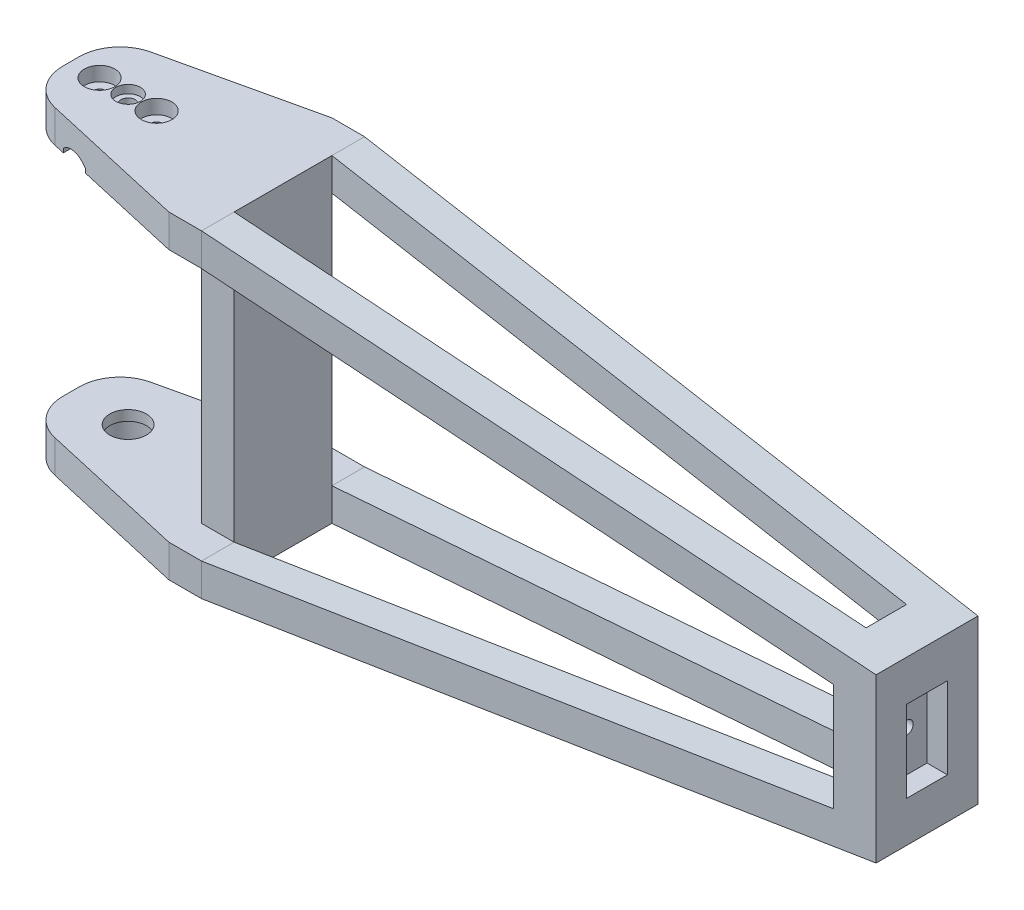
from build123d import *

# Parameters (mm, degrees)
SZKIC1_R                               = 4.5
DODANIE_WYCI_GNI_CIE1_DEPTH            = 8
SZKIC23_R                              = 6.5
WYTNIJ_WYCI_GNI_CIE11_DEPTH            = 5.5
SZKIC4_W                               = 8
SZKIC4_H                               = 40
DODANIE_WYCI_GNI_CIE2_DEPTH            = 62.15
DODANIE_WYCI_GNI_CIE3_DEPTH            = 8
WYTNIJ_WYCI_GNI_CIE3_REACH             = 91.171
SZKIC6_R                               = 1.6
SZKIC7_R                               = 3.75
WYTNIJ_WYCI_GNI_CIE4_DEPTH             = 3.5
WYTNIJ_WYCI_GNI_CIE5_REACH             = 97.976
WYTNIJ_WYCI_GNI_CIE5_DIRECTION_2_REACH = 97.976
SZKIC10_R                              = 3
WYTNIJ_WYCI_GNI_CIE6_DEPTH             = 2
WYTNIJ_WYCI_GNI_CIE7_REACH             = 93.888
SZKIC14_W                              = 8
SZKIC14_H                              = 62.15
DODANIE_WYCI_GNI_CIE5_DEPTH            = 78.15
WYTNIJ_WYCI_GNI_CIE9_DEPTH             = 215.763643338
WYTNIJ_WYCI_GNI_CIE9_DEPTH_BACK        = 215.763643338
SZKIC20_W                              = 10
SZKIC20_H                              = 20
WYTNIJ_WYCI_GNI_CIE10_DEPTH            = 5
ZAOKR_GLENIE1_R                        = 10
WYTNIJ_WYCI_GNI_CIE12_REACH            = 213.222
WYTNIJ_WYCI_GNI_CIE12_END_RADIUS       = 5
SZKIC24_R                              = 1.75
WYTNIJ_WYCI_GNI_CIE13_REACH            = 222.301
SZKIC25_R                              = 1.6


with BuildPart() as part:
    # Szkic1 → Dodanie-wyciągnięcie1 (new body)
    with BuildSketch(Plane(origin=(0, 0, 0), x_dir=(1, 0, 0), z_dir=(0, 1, 0))):
        Polygon((-14, -10), (30, -20), (38, -20), (38, 20), (30, 20), (-14, 10), align=None)
        with Locations(Location((0, 0, 0), (0, 0, 270))):
            Circle(SZKIC1_R, mode=Mode.SUBTRACT)
    extrude(amount=DODANIE_WYCI_GNI_CIE1_DEPTH)

    # Szkic23 → Wytnij-wyciągnięcie11 (cut)
    with BuildSketch(Plane.XZ):
        with Locations(Location((0, 0, 0), (0, 0, 270))):
            Circle(SZKIC23_R)
    extrude(amount=-WYTNIJ_WYCI_GNI_CIE11_DEPTH, mode=Mode.SUBTRACT)

    # Szkic4 → Dodanie-wyciągnięcie2 (add)
    with BuildSketch(Plane(origin=(0, 8, 0), x_dir=(1, 0, 0), z_dir=(0, 1, 0))):
        with Locations((34, 0)):
            Rectangle(SZKIC4_W, SZKIC4_H)
    extrude(amount=DODANIE_WYCI_GNI_CIE2_DEPTH)

    # Szkic5 → Dodanie-wyciągnięcie3 (add)
    with BuildSketch(Plane(origin=(0, 70.15, 0), x_dir=(1, 0, 0), z_dir=(0, 1, 0))):
        Polygon((38, -20), (38, 20), (30, 20), (-14, 10), (-14, -10), (30, -20), align=None)
    extrude(amount=DODANIE_WYCI_GNI_CIE3_DEPTH)

    # Szkic6 → Wytnij-wyciągnięcie3 (cut, up to next)
    with BuildSketch(Plane(origin=(0, 78.15, 0), x_dir=(1, 0, 0), z_dir=(0, 1, 0)), mode=Mode.PRIVATE) as wytnij_wyci_gni_cie3_sk1:
        with Locations(Location((-7, 0, 0), (0, 0, 270))):
            Circle(SZKIC6_R)
    wytnij_wyci_gni_cie3_tool1 = extrude(wytnij_wyci_gni_cie3_sk1.sketch, amount=-WYTNIJ_WYCI_GNI_CIE3_REACH, mode=Mode.PRIVATE) & part.part
    # Szkic6 → Wytnij-wyciągnięcie3 (cut, up to next)
    with BuildSketch(Plane(origin=(0, 78.15, 0), x_dir=(1, 0, 0), z_dir=(0, 1, 0)), mode=Mode.PRIVATE) as wytnij_wyci_gni_cie3_sk2:
        with Locations(Location((7, 0, 0), (0, 0, 270))):
            Circle(SZKIC6_R)
    wytnij_wyci_gni_cie3_tool2 = extrude(wytnij_wyci_gni_cie3_sk2.sketch, amount=-WYTNIJ_WYCI_GNI_CIE3_REACH, mode=Mode.PRIVATE) & part.part
    add(wytnij_wyci_gni_cie3_tool1.solids().sort_by_distance((-7, 78.15, 0))[0], mode=Mode.SUBTRACT)
    add(wytnij_wyci_gni_cie3_tool2.solids().sort_by_distance((7, 78.15, 0))[0], mode=Mode.SUBTRACT)

    # Szkic7 → Wytnij-wyciągnięcie4 (cut)
    with BuildSketch(Plane(origin=(0, 78.15, 0), x_dir=(1, 0, 0), z_dir=(0, 1, 0))):
        with Locations(Location((7, 0, 0), (0, 0, 270))):
            Circle(SZKIC7_R)
        with Locations(Location((-7, 0, 0), (0, 0, 270))):
            Circle(SZKIC7_R)
    extrude(amount=-WYTNIJ_WYCI_GNI_CIE4_DEPTH, mode=Mode.SUBTRACT)

    # Wytnij-wyciągnięcie5: up to this plane
    wytnij_wyci_gni_cie5_end = Plane(origin=(30, 78.15, -20), z_dir=(0.22162110358896817, 0, 0.9751328557914598))
    # Szkic9 → Wytnij-wyciągnięcie5 (cut, up to the surface)
    with BuildSketch(Plane(origin=(-14, 0, 0), x_dir=(1, 0, 0), z_dir=(0, 0, 1)), mode=Mode.PRIVATE) as wytnij_wyci_gni_cie5_sk1:
        with BuildLine():
            Line((10.5, 70.15), (17.5, 70.15))
            Line((17.5, 70.15), (17.5, 71.15))
            ThreePointArc((17.5, 71.15), (14, 72.579285786), (10.5, 71.15))
            Line((10.5, 71.15), (10.5, 70.15))
        make_face()
    wytnij_wyci_gni_cie5_tool1 = split(extrude(wytnij_wyci_gni_cie5_sk1.sketch, amount=-WYTNIJ_WYCI_GNI_CIE5_REACH, mode=Mode.PRIVATE), bisect_by=wytnij_wyci_gni_cie5_end, keep=Keep.BOTH, mode=Mode.PRIVATE)
    add(wytnij_wyci_gni_cie5_tool1.solids().sort_by_distance((0, 71.185303, 0))[0], mode=Mode.SUBTRACT)

    # Wytnij-wyciągnięcie5 direction 2: up to this plane
    wytnij_wyci_gni_cie5_direction_2_end = Plane(origin=(-14, 78.15, 10), z_dir=(0.22162110358896792, 0, -0.9751328557914598))
    # Szkic9 → Wytnij-wyciągnięcie5 direction 2 (cut, up to the surface)
    with BuildSketch(Plane(origin=(-14, 0, 0), x_dir=(1, 0, 0), z_dir=(0, 0, 1)), mode=Mode.PRIVATE) as wytnij_wyci_gni_cie5_direction_2_sk1:
        with BuildLine():
            Line((10.5, 70.15), (17.5, 70.15))
            Line((17.5, 70.15), (17.5, 71.15))
            ThreePointArc((17.5, 71.15), (14, 72.579285786), (10.5, 71.15))
            Line((10.5, 71.15), (10.5, 70.15))
        make_face()
    wytnij_wyci_gni_cie5_direction_2_tool1 = split(extrude(wytnij_wyci_gni_cie5_direction_2_sk1.sketch, amount=WYTNIJ_WYCI_GNI_CIE5_DIRECTION_2_REACH, mode=Mode.PRIVATE), bisect_by=wytnij_wyci_gni_cie5_direction_2_end, keep=Keep.BOTH, mode=Mode.PRIVATE)
    add(wytnij_wyci_gni_cie5_direction_2_tool1.solids().sort_by_distance((0, 71.185303, 0))[0], mode=Mode.SUBTRACT)

    # Szkic10 → Wytnij-wyciągnięcie6 (cut)
    with BuildSketch(Plane(origin=(0, 78.15, 0), x_dir=(1, 0, 0), z_dir=(0, 1, 0))):
        with Locations(Location((0, 0, 0), (0, 0, 270))):
            Circle(SZKIC10_R)
    extrude(amount=-WYTNIJ_WYCI_GNI_CIE6_DEPTH, mode=Mode.SUBTRACT)

    # Szkic14 → Wytnij-wyciągnięcie7 (cut, up to next)
    with BuildSketch(Plane.ZY.offset(-30), mode=Mode.PRIVATE) as wytnij_wyci_gni_cie7_sk1:
        with Locations((-16, 39.075)):
            Rectangle(SZKIC14_W, SZKIC14_H)
    wytnij_wyci_gni_cie7_tool1 = extrude(wytnij_wyci_gni_cie7_sk1.sketch, amount=-WYTNIJ_WYCI_GNI_CIE7_REACH, mode=Mode.PRIVATE) & part.part
    # Szkic14 → Wytnij-wyciągnięcie7 (cut, up to next)
    with BuildSketch(Plane.ZY.offset(-30), mode=Mode.PRIVATE) as wytnij_wyci_gni_cie7_sk2:
        with Locations((16, 39.075)):
            Rectangle(SZKIC14_W, SZKIC14_H)
    wytnij_wyci_gni_cie7_tool2 = extrude(wytnij_wyci_gni_cie7_sk2.sketch, amount=-WYTNIJ_WYCI_GNI_CIE7_REACH, mode=Mode.PRIVATE) & part.part
    add(wytnij_wyci_gni_cie7_tool1.solids().sort_by_distance((30, 39.075, -16))[0], mode=Mode.SUBTRACT)
    add(wytnij_wyci_gni_cie7_tool2.solids().sort_by_distance((30, 39.075, 16))[0], mode=Mode.SUBTRACT)

    # Szkic17 → Dodanie-wyciągnięcie5 (add, through all)
    with BuildSketch(Plane.XZ):
        Polygon((38, 20), (196, 12.5), (196, -12.5), (38, -20), (38, -11.990992093), (186, -4.965675637), (186, 4.965675637), (38, 11.990992093), align=None)
    extrude(amount=-DODANIE_WYCI_GNI_CIE5_DEPTH)

    # Szkic18 → Wytnij-wyciągnięcie9 (cut, two sides: drawn at the far end of the back side and taken through both)
    with BuildSketch(Plane(origin=(0, 0, -20), x_dir=(-1, 0, 0), z_dir=(0, 0, -1)).offset(-WYTNIJ_WYCI_GNI_CIE9_DEPTH_BACK)):
        Polygon((-196, 0), (-196, 19.075), (-38, 0), align=None)
        Polygon((-196, 59.075), (-196, 78.15), (-38, 78.15), align=None)
        Polygon((-38, 8), (-186, 25.867721519), (-186, 52.282278481), (-38, 70.15), align=None)
    extrude(amount=WYTNIJ_WYCI_GNI_CIE9_DEPTH + WYTNIJ_WYCI_GNI_CIE9_DEPTH_BACK, mode=Mode.SUBTRACT)

    # Szkic20 → Wytnij-wyciągnięcie10 (cut)
    with BuildSketch(Plane(origin=(196, 0, 0), x_dir=(0, 0, -1), z_dir=(1, 0, 0))):
        with Locations((0, 39.075)):
            Rectangle(SZKIC20_W, SZKIC20_H)
    extrude(amount=-WYTNIJ_WYCI_GNI_CIE10_DEPTH, mode=Mode.SUBTRACT)

    # Zaokrąglenie1
    zaokr_glenie1_edges = [part.edges().sort_by_distance(p)[0] for p in [
        (-14, 4, 10),
        (-14, 4, -10),
        (-14, 74.15, -10),
        (-14, 74.15, 10),
    ]]
    fillet(zaokr_glenie1_edges, radius=ZAOKR_GLENIE1_R)

    # Wytnij-wyciągnięcie12: up to this cylinder (the profile starts outside it)
    wytnij_wyci_gni_cie12_end = Plane(origin=(0, 67.579285786, 0), z_dir=(0, 0, -1)) * Cylinder(WYTNIJ_WYCI_GNI_CIE12_END_RADIUS, 437.444, mode=Mode.PRIVATE)
    # Szkic24 → Wytnij-wyciągnięcie12 (cut, up to the surface)
    with BuildSketch(Plane(origin=(0, 76.15, 0), x_dir=(1, 0, 0), z_dir=(0, 1, 0)), mode=Mode.PRIVATE) as wytnij_wyci_gni_cie12_sk1:
        with Locations(Location((0, 0, 0), (0, 0, 270))):
            Circle(SZKIC24_R)
    wytnij_wyci_gni_cie12_tool1 = extrude(wytnij_wyci_gni_cie12_sk1.sketch, amount=-WYTNIJ_WYCI_GNI_CIE12_REACH, mode=Mode.PRIVATE) - wytnij_wyci_gni_cie12_end
    add(wytnij_wyci_gni_cie12_tool1.solids().sort_by_distance((0, 76.15, 0))[0], mode=Mode.SUBTRACT)

    # Szkic25 → Wytnij-wyciągnięcie13 (cut, up to next)
    with BuildSketch(Plane(origin=(191, 0, 0), x_dir=(0, 0, -1), z_dir=(1, 0, 0)), mode=Mode.PRIVATE) as wytnij_wyci_gni_cie13_sk1:
        with Locations((0, 39.075)):
            Circle(SZKIC25_R)
    wytnij_wyci_gni_cie13_tool1 = extrude(wytnij_wyci_gni_cie13_sk1.sketch, amount=-WYTNIJ_WYCI_GNI_CIE13_REACH, mode=Mode.PRIVATE) & part.part
    add(wytnij_wyci_gni_cie13_tool1.solids().sort_by_distance((191, 39.075, 0))[0], mode=Mode.SUBTRACT)


solid = part.part
